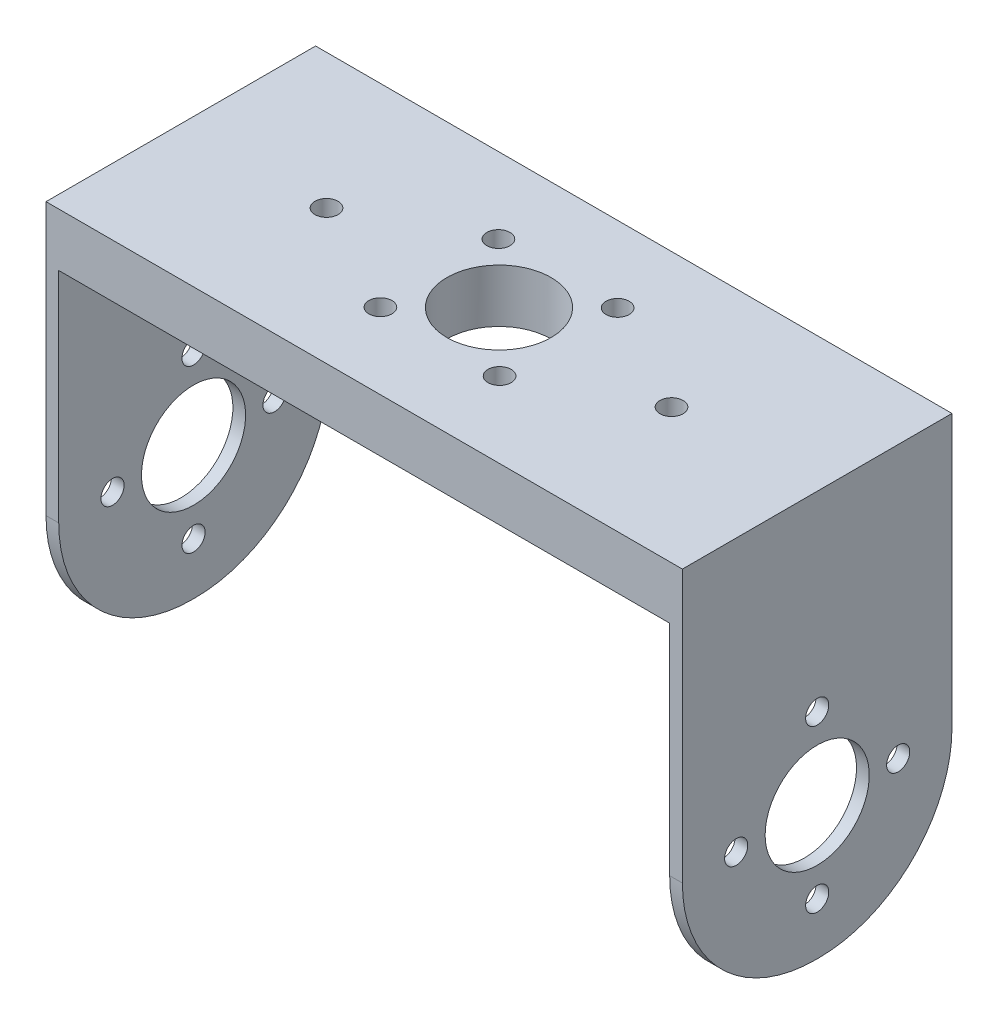
from build123d import *

# Parameters (mm, degrees)
SKETCH1_W                = 55
SKETCH1_H                = 23.3
MOUNTPLATE_DEPTH         = 4.6
SKETCH3_R                = 4.5
AXLEHOLE_MOUNT_DEPTH     = 4.6
SKETCH2_R                = 1
MOUNTHOLES_DEPTH         = 4.6
SKETCH4_W                = 1.1
SKETCH4_H                = 23.3
SERVOLEGS_DEPTH          = 30.4
CENTERHOLES_REACH        = 69.023
SKETCH5_R                = 4.5
ROTATOR_MOUNTHOLES_REACH = 69.023
SKETCH6_R                = 1
FILLET1_R                = 11.5
FILLET2_R                = 11.5
FILLET3_R                = 11.5
FILLET4_R                = 11.5


with BuildPart() as part:
    # Sketch1 → MountPlate (new body)
    with BuildSketch(Plane(origin=(0, 0, 0), x_dir=(1, 0, 0), z_dir=(0, 1, 0))):
        with Locations((27.5, 11.65)):
            Rectangle(SKETCH1_W, SKETCH1_H)
    extrude(amount=MOUNTPLATE_DEPTH)

    # Sketch3 → AxleHole-Mount (cut)
    with BuildSketch(Plane(origin=(0, 4.6, 0), x_dir=(1, 0, 0), z_dir=(0, 1, 0))):
        with Locations(Location((27.5, 11.65, 0), (0, 0, 270))):
            Circle(SKETCH3_R)
    extrude(amount=-AXLEHOLE_MOUNT_DEPTH, mode=Mode.SUBTRACT)

    # Sketch2 → MountHoles (cut)
    with BuildSketch(Plane(origin=(0, 4.6, 0), x_dir=(1, 0, 0), z_dir=(0, 1, 0))):
        with Locations(Location((22.35, 16.75, 0), (0, 0, 270))):
            Circle(SKETCH2_R)
        with Locations(Location((12.59, 11.65, 0), (0, 0, 270))):
            Circle(SKETCH2_R)
        with Locations(Location((32.65, 16.75, 0), (0, 0, 270))):
            Circle(SKETCH2_R)
        with Locations(Location((22.35, 6.55, 0), (0, 0, 270))):
            Circle(SKETCH2_R)
        with Locations(Location((42.41, 11.65, 0), (0, 0, 270))):
            Circle(SKETCH2_R)
        with Locations(Location((32.65, 6.55, 0), (0, 0, 270))):
            Circle(SKETCH2_R)
    extrude(amount=-MOUNTHOLES_DEPTH, mode=Mode.SUBTRACT)

    # Sketch4 → ServoLegs (add)
    with BuildSketch(Plane.XZ):
        with Locations((54.45, -11.65)):
            Rectangle(SKETCH4_W, SKETCH4_H)
        with Locations((0.55, -11.65)):
            Rectangle(SKETCH4_W, SKETCH4_H)
    extrude(amount=SERVOLEGS_DEPTH)

    # CenterHoles: up to this face of the body (flat: up to its plane)
    centerholes_end = Plane(part.part.faces().sort_by_distance((55, -12.9, -11.65))[0])
    # Sketch5 → CenterHoles (cut, up to the picked face)
    with BuildSketch(Plane.ZY, mode=Mode.PRIVATE) as centerholes_sk1:
        with Locations((-11.65, -18.9)):
            Circle(SKETCH5_R)
    centerholes_tool1 = split(extrude(centerholes_sk1.sketch, amount=-CENTERHOLES_REACH, mode=Mode.PRIVATE), bisect_by=centerholes_end, keep=Keep.BOTH, mode=Mode.PRIVATE)
    add(centerholes_tool1.solids().sort_by(Axis((0, -18.9, -11.65), (1, 0, 0)))[0], mode=Mode.SUBTRACT)

    # Rotator-MountHoles: up to this face of the body (flat: up to its plane)
    rotator_mountholes_end = Plane(part.part.faces().sort_by_distance((55, -12.392336394, -11.65))[0])
    # Sketch6 → Rotator-MountHoles (cut, up to the picked face)
    with BuildSketch(Plane.ZY, mode=Mode.PRIVATE) as rotator_mountholes_sk1:
        with Locations((-11.65, -25.9)):
            Circle(SKETCH6_R)
    rotator_mountholes_tool1 = split(extrude(rotator_mountholes_sk1.sketch, amount=-ROTATOR_MOUNTHOLES_REACH, mode=Mode.PRIVATE), bisect_by=rotator_mountholes_end, keep=Keep.BOTH, mode=Mode.PRIVATE)
    # Sketch6 → Rotator-MountHoles (cut, up to the picked face)
    with BuildSketch(Plane.ZY, mode=Mode.PRIVATE) as rotator_mountholes_sk2:
        with Locations((-18.65, -18.9)):
            Circle(SKETCH6_R)
    rotator_mountholes_tool2 = split(extrude(rotator_mountholes_sk2.sketch, amount=-ROTATOR_MOUNTHOLES_REACH, mode=Mode.PRIVATE), bisect_by=rotator_mountholes_end, keep=Keep.BOTH, mode=Mode.PRIVATE)
    # Sketch6 → Rotator-MountHoles (cut, up to the picked face)
    with BuildSketch(Plane.ZY, mode=Mode.PRIVATE) as rotator_mountholes_sk3:
        with Locations((-11.65, -11.9)):
            Circle(SKETCH6_R)
    rotator_mountholes_tool3 = split(extrude(rotator_mountholes_sk3.sketch, amount=-ROTATOR_MOUNTHOLES_REACH, mode=Mode.PRIVATE), bisect_by=rotator_mountholes_end, keep=Keep.BOTH, mode=Mode.PRIVATE)
    # Sketch6 → Rotator-MountHoles (cut, up to the picked face)
    with BuildSketch(Plane.ZY, mode=Mode.PRIVATE) as rotator_mountholes_sk4:
        with Locations((-4.65, -18.9)):
            Circle(SKETCH6_R)
    rotator_mountholes_tool4 = split(extrude(rotator_mountholes_sk4.sketch, amount=-ROTATOR_MOUNTHOLES_REACH, mode=Mode.PRIVATE), bisect_by=rotator_mountholes_end, keep=Keep.BOTH, mode=Mode.PRIVATE)
    add(rotator_mountholes_tool1.solids().sort_by(Axis((0, -25.9, -11.65), (1, 0, 0)))[0], mode=Mode.SUBTRACT)
    add(rotator_mountholes_tool2.solids().sort_by(Axis((0, -18.9, -18.65), (1, 0, 0)))[0], mode=Mode.SUBTRACT)
    add(rotator_mountholes_tool3.solids().sort_by(Axis((0, -11.9, -11.65), (1, 0, 0)))[0], mode=Mode.SUBTRACT)
    add(rotator_mountholes_tool4.solids().sort_by(Axis((0, -18.9, -4.65), (1, 0, 0)))[0], mode=Mode.SUBTRACT)

    # Fillet1
    fillet1_edges = [part.edges().sort_by_distance(p)[0] for p in [
        (0.55, -30.4, -23.3),
    ]]
    fillet(fillet1_edges, radius=FILLET1_R)

    # Fillet2
    fillet2_edges = [part.edges().sort_by_distance(p)[0] for p in [
        (0.55, -30.4, 0),
    ]]
    fillet(fillet2_edges, radius=FILLET2_R)

    # Fillet3
    fillet3_edges = [part.edges().sort_by_distance(p)[0] for p in [
        (54.45, -30.4, 0),
    ]]
    fillet(fillet3_edges, radius=FILLET3_R)

    # Fillet4
    fillet4_edges = [part.edges().sort_by_distance(p)[0] for p in [
        (54.45, -30.4, -23.3),
    ]]
    fillet(fillet4_edges, radius=FILLET4_R)


solid = part.part
